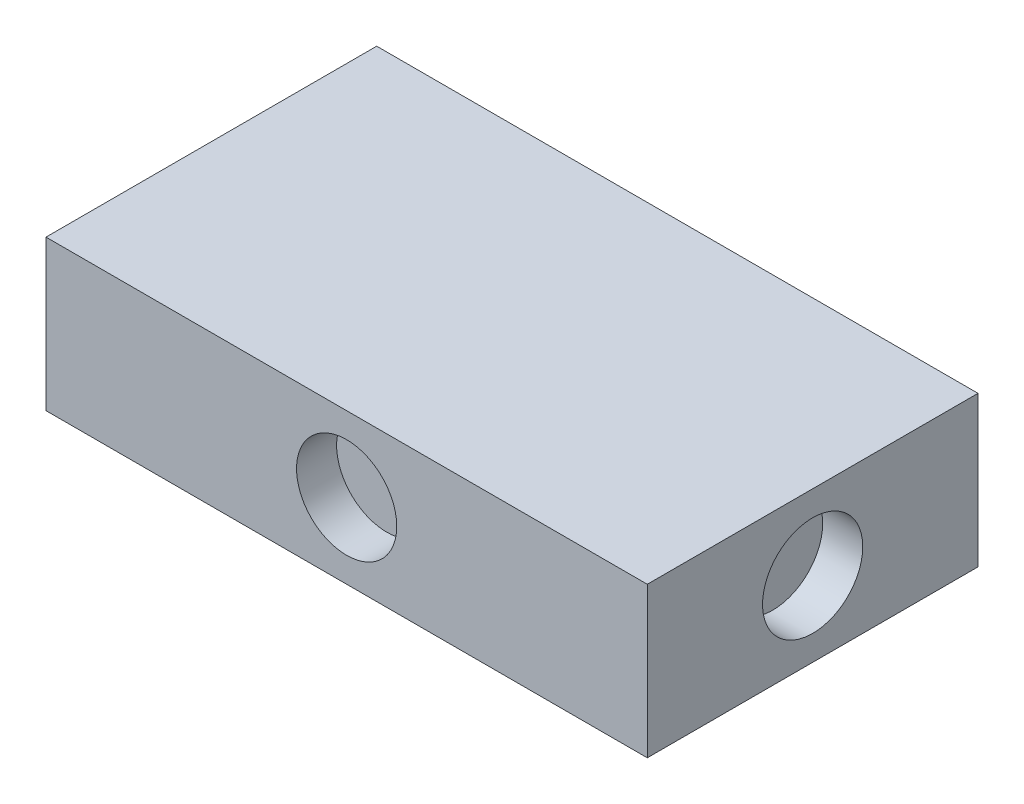
from build123d import *

# Parameters (mm, degrees)
SKETCH1_W           = 76.2
SKETCH1_H           = 41.91
BOSS_EXTRUDE1_DEPTH = 19.05
SKETCH5_R           = 6.35
CUT_EXTRUDE1_DEPTH  = 5.08
SKETCH2_R           = 6.35
CUT_EXTRUDE2_DEPTH  = 5.08
CUT_EXTRUDE3_START  = -5.08
SKETCH3_R           = 6.35
CUT_EXTRUDE3_DEPTH  = 5.08
CUT_EXTRUDE4_START  = -5.08
SKETCH4_R           = 6.35
CUT_EXTRUDE4_DEPTH  = 5.08


with BuildPart() as part:
    # Sketch1 → Boss-Extrude1 (new body)
    with BuildSketch(Plane(origin=(0, 0, 0), x_dir=(1, 0, 0), z_dir=(0, 1, 0))):
        Rectangle(SKETCH1_W, SKETCH1_H)
    extrude(amount=BOSS_EXTRUDE1_DEPTH)

    # Sketch5 → Cut-Extrude1 (cut)
    with BuildSketch(Plane(origin=(38.1, 0, 0), x_dir=(0, 0, -1), z_dir=(1, 0, 0))):
        with Locations((0, 9.525)):
            Circle(SKETCH5_R)
    extrude(amount=-CUT_EXTRUDE1_DEPTH, mode=Mode.SUBTRACT)

    # Sketch2 → Cut-Extrude2 (cut)
    with BuildSketch(Plane.XY.offset(20.955)):
        with Locations((0, 9.525)):
            Circle(SKETCH2_R)
    extrude(amount=-CUT_EXTRUDE2_DEPTH, mode=Mode.SUBTRACT)

    # Sketch3 → Cut-Extrude3 (cut)
    with BuildSketch(Plane(origin=(0, 0, -20.955), x_dir=(-1, 0, 0), z_dir=(0, 0, -1)).offset(CUT_EXTRUDE3_START)):
        with Locations(Location((0, 9.525, 0), (0, 0, 180))):
            Circle(SKETCH3_R)
    extrude(amount=CUT_EXTRUDE3_DEPTH, mode=Mode.SUBTRACT)

    # Sketch4 → Cut-Extrude4 (cut)
    with BuildSketch(Plane.ZY.offset(38.1).offset(CUT_EXTRUDE4_START)):
        with Locations(Location((0, 9.525, 0), (0, 0, 180))):
            Circle(SKETCH4_R)
    extrude(amount=CUT_EXTRUDE4_DEPTH, mode=Mode.SUBTRACT)


solid = part.part
